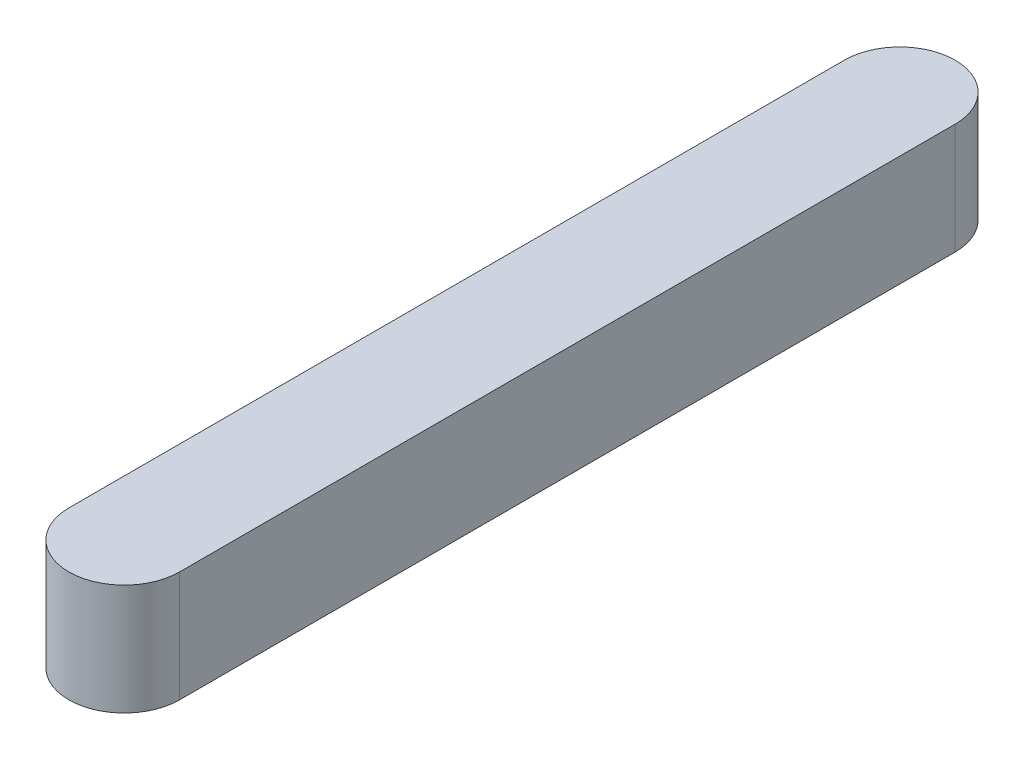
from build123d import *

# Parameters (mm, degrees)
BOSS_EXTRUDE1_START = 2.5
BOSS_EXTRUDE1_DEPTH = 5


with BuildPart() as part:
    # Sketch4 → Boss-Extrude1 (new body)
    with BuildSketch(Plane(origin=(0, 0, 0), x_dir=(1, 0, 0), z_dir=(0, 1, 0)).offset(BOSS_EXTRUDE1_START)):
        with BuildLine():
            Line((-2.5, -17.5), (-2.5, 17.5))
            ThreePointArc((-2.5, 17.5), (0, 20), (2.5, 17.5))
            Line((2.5, 17.5), (2.5, -17.5))
            ThreePointArc((2.5, -17.5), (0, -20), (-2.5, -17.5))
        make_face()
    extrude(amount=-BOSS_EXTRUDE1_DEPTH)


solid = part.part
